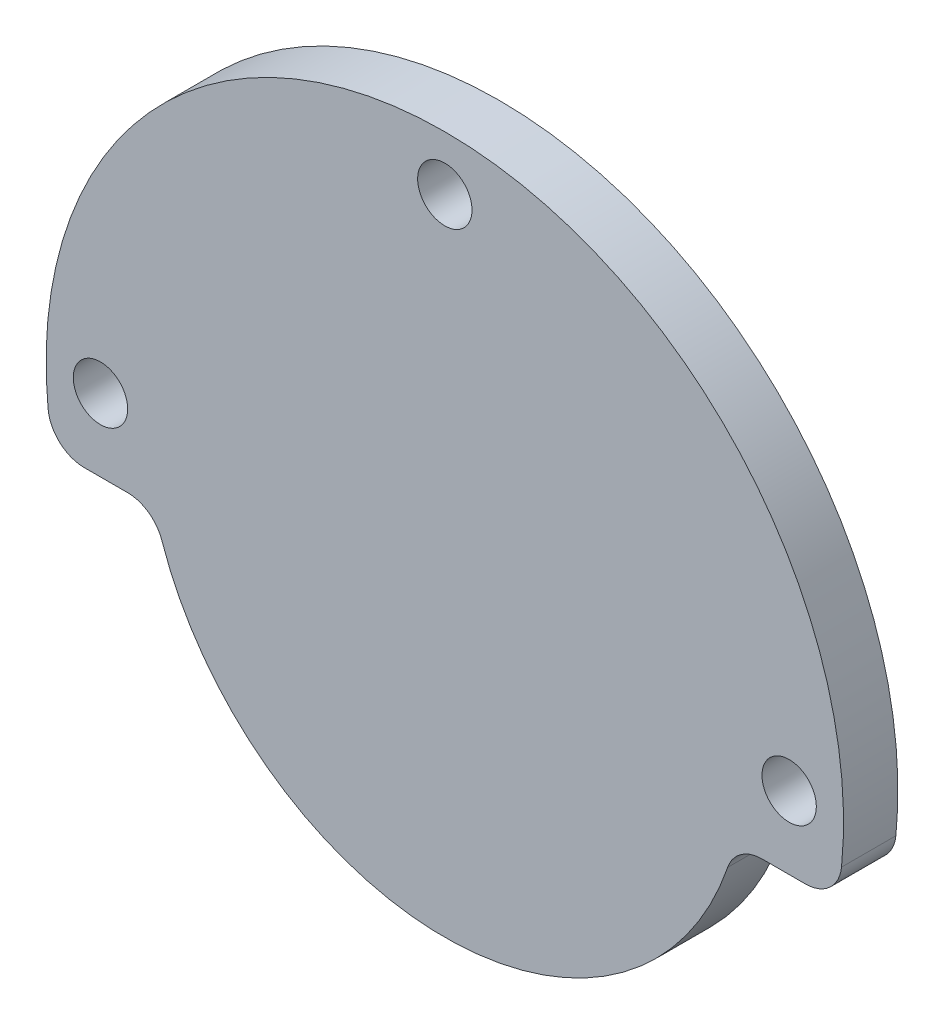
from build123d import *

# Parameters (mm, degrees)
SKETCH_1_R      = 1.5
EXTRUDE_1_DEPTH = 3
FILLET_1_R      = 2


with BuildPart() as part:
    # 草图1 → 凸台-拉伸1 (new body)
    with BuildSketch(Plane.XY):
        with BuildLine():
            Line((-16.007810594, -4), (-21.633307653, -4))
            ThreePointArc((-21.633307653, -4), (0, 22), (21.633307653, -4))
            Line((21.633307653, -4), (16.007810594, -4))
            ThreePointArc((16.007810594, -4), (0, -16.5), (-16.007810594, -4))
        make_face()
        with Locations((-19, 0)):
            Circle(SKETCH_1_R, mode=Mode.SUBTRACT)
        with Locations((0, 19)):
            Circle(SKETCH_1_R, mode=Mode.SUBTRACT)
        with Locations((19, 0)):
            Circle(SKETCH_1_R, mode=Mode.SUBTRACT)
    extrude(amount=EXTRUDE_1_DEPTH)

    # 圆角1
    fillet_1_edges = [part.edges().sort_by_distance(p)[0] for p in [
        (-16.007810594, -4, 1.5),
        (-21.633307653, -4, 1.5),
        (21.633307653, -4, 1.5),
        (16.007810594, -4, 1.5),
    ]]
    fillet(fillet_1_edges, radius=FILLET_1_R)


solid = part.part
